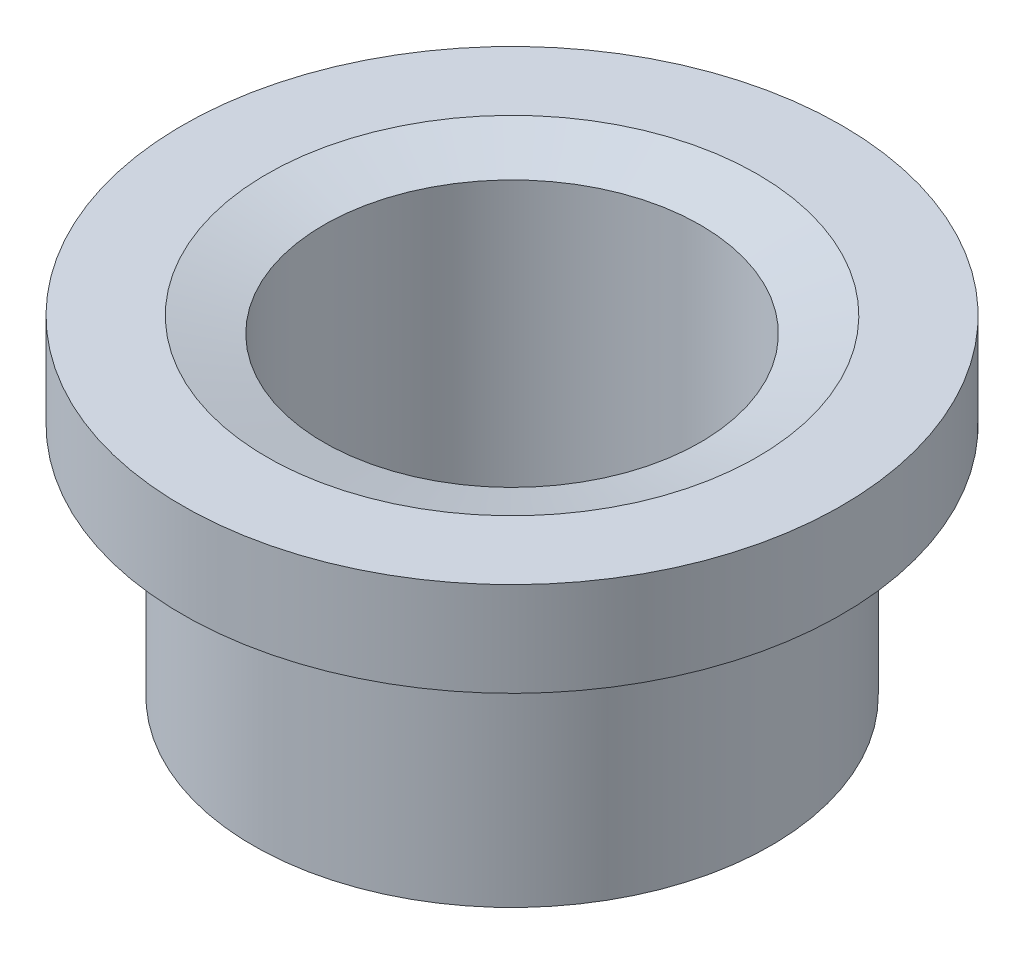
from build123d import *


with BuildPart() as part:
    # 草图1 → 旋转1 (revolve)
    with BuildSketch(Plane.XY, mode=Mode.PRIVATE) as revolve_1_sk:
        Polygon((12, 0), (16.5, 0), (16.5, 15), (21, 15), (21, 21), (15.625, 21), (12, 20), align=None)
    revolve(revolve_1_sk.sketch.rotate(Axis((0, 0, 0), (0, 1, 0)), 90), axis=Axis((0, 0, 0), (0, 1, 0)))


solid = part.part
